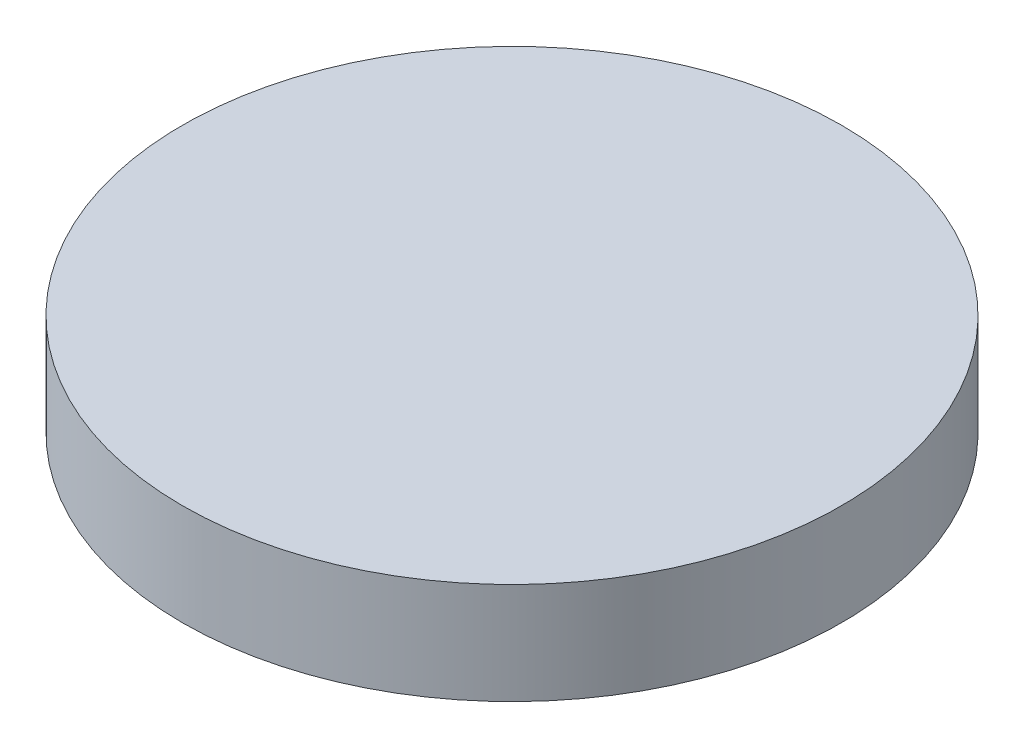
from build123d import *

# Parameters (mm, degrees)
ESBO_O1_R                = 32.5
RESSALTO_EXTRUS_O1_DEPTH = 10


with BuildPart() as part:
    # Esboço1 → Ressalto-extrusão1 (new body)
    with BuildSketch(Plane(origin=(0, 0, 0), x_dir=(1, 0, 0), z_dir=(0, 1, 0))):
        with Locations(Location((0, 0, 0), (0, 0, 270))):
            Circle(ESBO_O1_R)
    extrude(amount=RESSALTO_EXTRUS_O1_DEPTH)


solid = part.part
